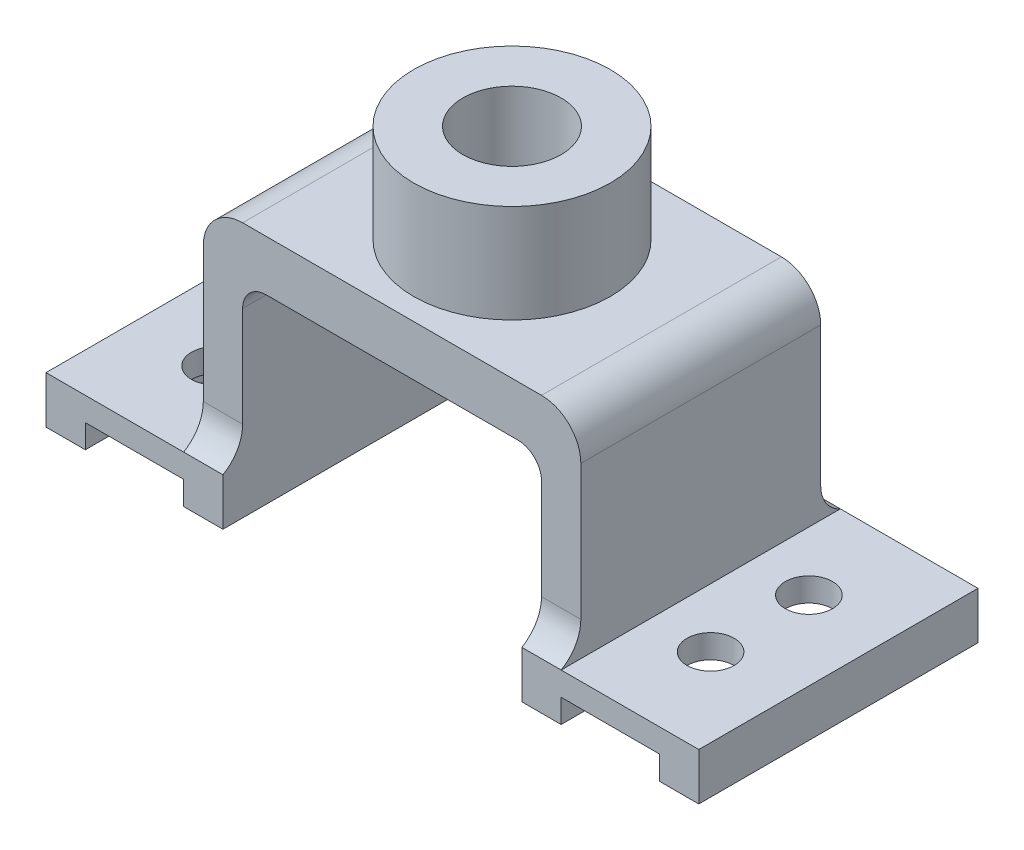
from build123d import *

# Parameters (mm, degrees)
SKETCH1_W           = 166
SKETCH1_H           = 71
BOSS_EXTRUDE1_DEPTH = 12
SKETCH2_R           = 6
CUT_EXTRUDE1_DEPTH  = 181.944742947
SKETCH3_W           = 96
SKETCH3_H           = 71
BOSS_EXTRUDE2_DEPTH = 53
SKETCH4_W           = 25
SKETCH4_H           = 6
CUT_EXTRUDE2_DEPTH  = 192.890593829
SKETCH5_W           = 5
SKETCH5_H           = 53
CUT_EXTRUDE4_DEPTH  = 163.563833616
BOSS_EXTRUDE4_DEPTH = 10
BOSS_EXTRUDE5_START = -10
BOSS_EXTRUDE5_DEPTH = 10
FILLET4_R           = 10
FILLET5_R           = 10
SKETCH11_R          = 25
SKETCH11_R_2        = 12.5
BOSS_EXTRUDE6_DEPTH = 25
SKETCH12_R          = 12.5
CUT_EXTRUDE5_DEPTH  = 192.890593829


with BuildPart() as part:
    # Sketch1 → Boss-Extrude1 (new body)
    with BuildSketch(Plane(origin=(0, 0, 0), x_dir=(1, 0, 0), z_dir=(0, 1, 0))):
        with Locations((83, 35.5)):
            Rectangle(SKETCH1_W, SKETCH1_H)
    extrude(amount=BOSS_EXTRUDE1_DEPTH)

    # Sketch2 → Cut-Extrude1 (cut, through all)
    with BuildSketch(Plane(origin=(0, 12, 0), x_dir=(1, 0, 0), z_dir=(0, 1, 0))):
        with Locations(Location((20, 48, 0), (0, 0, 270))):
            Circle(SKETCH2_R)
        with Locations(Location((20, 23, 0), (0, 0, 270))):
            Circle(SKETCH2_R)
        with Locations(Location((146, 48, 0), (0, 0, 270))):
            Circle(SKETCH2_R)
        with Locations(Location((146, 23, 0), (0, 0, 270))):
            Circle(SKETCH2_R)
    extrude(amount=-CUT_EXTRUDE1_DEPTH, mode=Mode.SUBTRACT)

    # Sketch3 → Boss-Extrude2 (add)
    with BuildSketch(Plane(origin=(0, 12, 0), x_dir=(1, 0, 0), z_dir=(0, 1, 0))):
        with Locations((83, 35.5)):
            Rectangle(SKETCH3_W, SKETCH3_H)
    extrude(amount=BOSS_EXTRUDE2_DEPTH)

    # Sketch4 → Cut-Extrude2 (cut, through all)
    with BuildSketch(Plane.XY):
        with BuildLine():
            Line((45, 0), (121, 0))
            Line((121, 0), (121, 46.135540556))
            ThreePointArc((121, 46.135540556), (119.242640687, 50.378181243), (115, 52.135540556))
            Line((115, 52.135540556), (51, 52.135540556))
            ThreePointArc((51, 52.135540556), (46.757359313, 50.378181243), (45, 46.135540556))
            Line((45, 46.135540556), (45, 0))
        make_face()
        with Locations((22.5, 3)):
            Rectangle(SKETCH4_W, SKETCH4_H)
        with Locations((143.5, 3)):
            Rectangle(SKETCH4_W, SKETCH4_H)
    extrude(amount=-CUT_EXTRUDE2_DEPTH, mode=Mode.SUBTRACT)

    # Sketch5 → Cut-Extrude4 (cut, through all)
    with BuildSketch(Plane.ZY.offset(-35)):
        with Locations((-68.5, 38.5)):
            Rectangle(SKETCH5_W, SKETCH5_H)
        with Locations((-2.5, 38.5)):
            Rectangle(SKETCH5_W, SKETCH5_H)
    extrude(amount=-CUT_EXTRUDE4_DEPTH, mode=Mode.SUBTRACT)

    # Sketch7 → Boss-Extrude4 (add)
    with BuildSketch(Plane.ZY.offset(-35)):
        with BuildLine():
            Line((-71, 12), (-66, 12))
            Line((-66, 12), (-66, 19.610148588))
            ThreePointArc((-66, 19.610148588), (-67.361838539, 15.057282415), (-71, 12))
        make_face()
        with BuildLine():
            Line((-5, 20.660254038), (-5, 12))
            Line((-5, 12), (0, 12))
            ThreePointArc((0, 12), (-3.660254038, 15.660254038), (-5, 20.660254038))
        make_face()
    extrude(amount=-BOSS_EXTRUDE4_DEPTH)

    # Sketch10 → Boss-Extrude5 (add)
    with BuildSketch(Plane(origin=(131, 0, 0), x_dir=(0, 0, -1), z_dir=(1, 0, 0)).offset(BOSS_EXTRUDE5_START)):
        with BuildLine():
            Line((5, 20.660254038), (5, 12))
            Line((5, 12), (0, 12))
            ThreePointArc((0, 12), (3.660254038, 15.660254038), (5, 20.660254038))
        make_face()
        with BuildLine():
            Line((71, 12), (66, 12))
            Line((66, 12), (66, 19.610148588))
            ThreePointArc((66, 19.610148588), (67.361838539, 15.057282415), (71, 12))
        make_face()
    extrude(amount=BOSS_EXTRUDE5_DEPTH)

    # Fillet4
    fillet4_edges = [part.edges().sort_by_distance(p)[0] for p in [
        (35, 65, -35.5),
    ]]
    fillet(fillet4_edges, radius=FILLET4_R)

    # Fillet5
    fillet5_edges = [part.edges().sort_by_distance(p)[0] for p in [
        (131, 65, -35.5),
    ]]
    fillet(fillet5_edges, radius=FILLET5_R)

    # Sketch11 → Boss-Extrude6 (add)
    with BuildSketch(Plane(origin=(0, 65, 0), x_dir=(1, 0, 0), z_dir=(0, 1, 0))):
        with Locations(Location((83, 35.5, 0), (0, 0, 270))):
            Circle(SKETCH11_R)
        with Locations(Location((83, 35.5, 0), (0, 0, 270))):
            Circle(SKETCH11_R_2, mode=Mode.SUBTRACT)
    extrude(amount=BOSS_EXTRUDE6_DEPTH)

    # Sketch12 → Cut-Extrude5 (cut, through all)
    with BuildSketch(Plane(origin=(0, 65, 0), x_dir=(1, 0, 0), z_dir=(0, 1, 0))):
        with Locations(Location((83, 35.5, 0), (0, 0, 270))):
            Circle(SKETCH12_R)
    extrude(amount=-CUT_EXTRUDE5_DEPTH, mode=Mode.SUBTRACT)


solid = part.part
